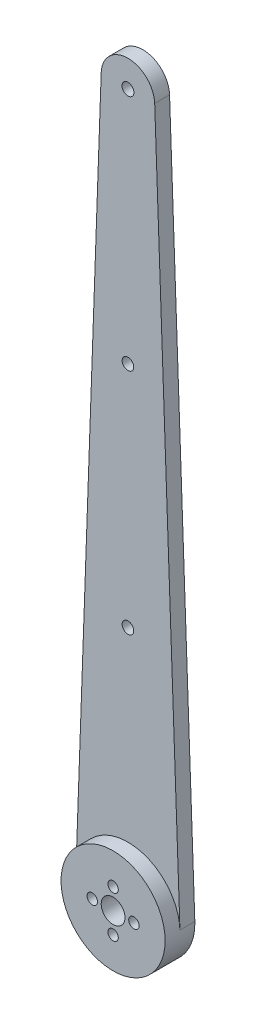
from build123d import *

# Parameters (mm, degrees)
SKETCH7_R                = 4
SKETCH7_R_2              = 2
BOSS_EXTRUDE1_DEPTH      = 5
HOLE_WIZARD_M3_5_1_D     = 3.9
HOLE_WIZARD_M3_5_1_DEPTH = 10
HOLE_WIZARD_M3_5_1_TIP   = 1.171678207
SKETCH_4_R               = 1.75
CUT_EXTRUDE_1_DEPTH      = 10
EXTRUDE_START            = 5
SKETCH_5_R               = 17.5
SKETCH_5_R_2             = 1.75
SKETCH_5_R_3             = 4
EXTRUDE_1_DEPTH          = 5


with BuildPart() as part:
    # Sketch7 → Boss-Extrude1 (new body)
    with BuildSketch(Plane.XY):
        with BuildLine():
            Line((8.994200014, 237.123057432), (17.48872225, 0.62816723))
            ThreePointArc((17.48872225, 0.62816723), (0, -17.5), (-17.48872225, 0.62816723))
            Line((-17.48872225, 0.62816723), (-8.994200014, 237.123057432))
            ThreePointArc((-8.994200014, 237.123057432), (0, 245.8), (8.994200014, 237.123057432))
        make_face()
        Circle(SKETCH7_R, mode=Mode.SUBTRACT)
        with Locations((0, 236.8)):
            Circle(SKETCH7_R_2, mode=Mode.SUBTRACT)
    extrude(amount=-BOSS_EXTRUDE1_DEPTH)

    # M3.5 间隙孔1
    with Locations(Plane(origin=(0, 156.8, 0), x_dir=(1, 0, 0), z_dir=(0, 0, 1))):
        with Locations((0, 0), (0, -76.8)):
            Hole(HOLE_WIZARD_M3_5_1_D / 2, depth=HOLE_WIZARD_M3_5_1_DEPTH)
            with Locations((0, 0, -(HOLE_WIZARD_M3_5_1_DEPTH + HOLE_WIZARD_M3_5_1_TIP / 2))):  # 118° drill point
                Cone(0, HOLE_WIZARD_M3_5_1_D / 2, HOLE_WIZARD_M3_5_1_TIP, mode=Mode.SUBTRACT)

    # 草图4 → 切除-拉伸1 (cut)
    with BuildSketch(Plane.XY):
        with Locations((7, 0)):
            Circle(SKETCH_4_R)
        with Locations((0, 7)):
            Circle(SKETCH_4_R)
        with Locations((0, -7)):
            Circle(SKETCH_4_R)
        with Locations((-7, 0)):
            Circle(SKETCH_4_R)
    extrude(amount=-CUT_EXTRUDE_1_DEPTH, mode=Mode.SUBTRACT)

    # 草图5 → 凸台-拉伸1 (add)
    with BuildSketch(Plane.XY.offset(EXTRUDE_START)):
        Circle(SKETCH_5_R)
        with Locations((7, 0)):
            Circle(SKETCH_5_R_2, mode=Mode.SUBTRACT)
        with Locations((0, -7)):
            Circle(SKETCH_5_R_2, mode=Mode.SUBTRACT)
        Circle(SKETCH_5_R_3, mode=Mode.SUBTRACT)
        with Locations((-7, 0)):
            Circle(SKETCH_5_R_2, mode=Mode.SUBTRACT)
        with Locations((0, 7)):
            Circle(SKETCH_5_R_2, mode=Mode.SUBTRACT)
    extrude(amount=-EXTRUDE_1_DEPTH)


solid = part.part
